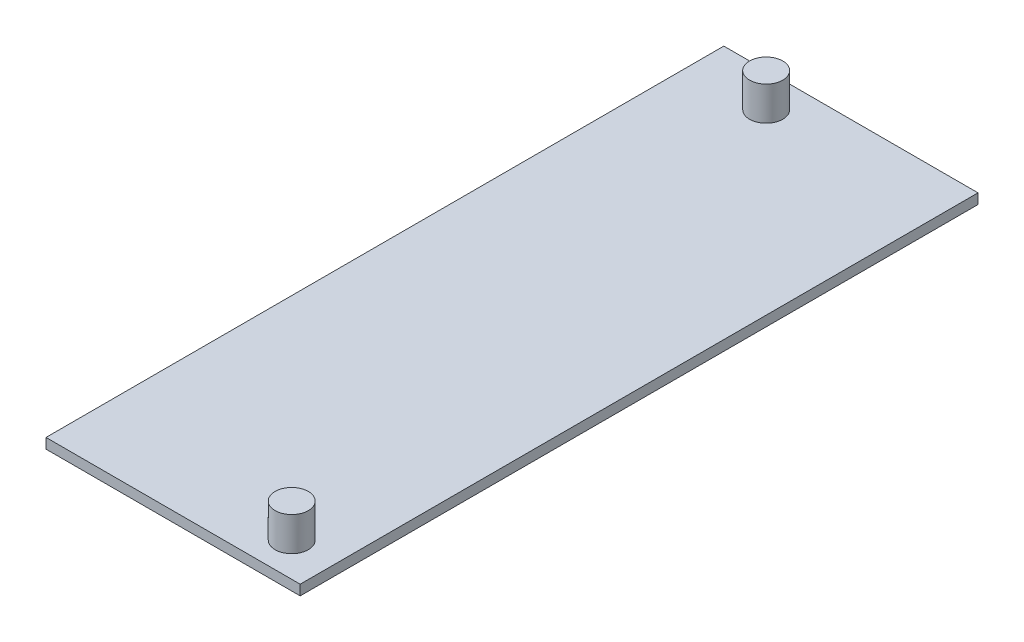
from build123d import *

# Parameters (mm, degrees)
SKETCH1_W           = 75
SKETCH1_H           = 3
BOSS_EXTRUDE1_DEPTH = 200
SKETCH2_R           = 4.9
BOSS_EXTRUDE2_DEPTH = 10
SKETCH5_W           = 5
SKETCH5_H           = 30
CUT_EXTRUDE2_DEPTH  = 1


with BuildPart() as part:
    # Sketch1 → Boss-Extrude1 (new body)
    with BuildSketch(Plane.XY):
        with Locations((37.5, 1.5)):
            Rectangle(SKETCH1_W, SKETCH1_H)
    extrude(amount=BOSS_EXTRUDE1_DEPTH)

    # Sketch2 → Boss-Extrude2 (add)
    with BuildSketch(Plane(origin=(0, 3, 0), x_dir=(1, 0, 0), z_dir=(0, 1, 0))):
        with Locations(Location((62.5, -190, 0), (0, 0, 90))):
            Circle(SKETCH2_R)
        with Locations(Location((22.5, -10, 0), (0, 0, 90))):
            Circle(SKETCH2_R)
    extrude(amount=BOSS_EXTRUDE2_DEPTH)

    # Sketch5 → Cut-Extrude2 (cut)
    with BuildSketch(Plane.XZ):
        with Locations((47.5, 165)):
            Rectangle(SKETCH5_W, SKETCH5_H)
        with Locations((47.5, 115)):
            Rectangle(SKETCH5_W, SKETCH5_H)
        with Locations((47.5, 65)):
            Rectangle(SKETCH5_W, SKETCH5_H)
        with Locations((47.5, 15)):
            Rectangle(SKETCH5_W, SKETCH5_H)
    extrude(amount=-CUT_EXTRUDE2_DEPTH, mode=Mode.SUBTRACT)


solid = part.part
